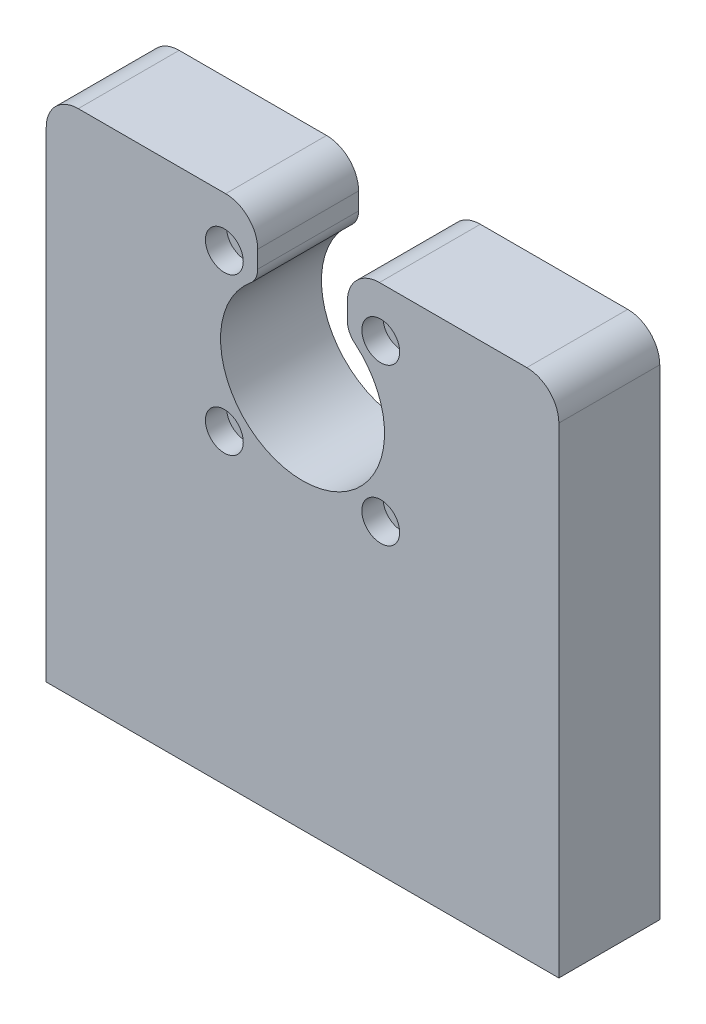
from build123d import *

# Parameters (mm, degrees)
BOSS_EXTRUDE1_DEPTH = 20
SKETCH2_R           = 16.25
SKETCH2_R_2         = 2.15
CUT_EXTRUDE1_DEPTH  = 20
SKETCH5_R           = 3.75
CUT_EXTRUDE4_DEPTH  = 4.2
FILLET3_R           = 4
FILLET4_R           = 6.35


with BuildPart() as part:
    # Sketch1 → Boss-Extrude1 (new body)
    with BuildSketch(Plane.XY):
        Polygon((50.8, 25.4), (8.89, 25.4), (8.89, 13.302928249), (-8.89, 13.302928249), (-8.89, 25.4), (-50.8, 25.4), (-50.8, -76.2), (50.8, -76.2), align=None)
    extrude(amount=BOSS_EXTRUDE1_DEPTH)

    # Sketch2 → Cut-Extrude1 (cut)
    with BuildSketch(Plane.XY.offset(20)):
        Circle(SKETCH2_R)
        with Locations((-15.5, -15.5)):
            Circle(SKETCH2_R_2)
        with Locations((-15.5, 15.5)):
            Circle(SKETCH2_R_2)
        with Locations((15.5, -15.5)):
            Circle(SKETCH2_R_2)
        with Locations((15.5, 15.5)):
            Circle(SKETCH2_R_2)
    extrude(amount=-CUT_EXTRUDE1_DEPTH, mode=Mode.SUBTRACT)

    # Sketch5 → Cut-Extrude4 (cut)
    with BuildSketch(Plane.XY.offset(20)):
        with Locations((-15.5, 15.5)):
            Circle(SKETCH5_R)
        with Locations((15.5, 15.5)):
            Circle(SKETCH5_R)
        with Locations((15.5, -15.5)):
            Circle(SKETCH5_R)
        with Locations((-15.5, -15.5)):
            Circle(SKETCH5_R)
    extrude(amount=-CUT_EXTRUDE4_DEPTH, mode=Mode.SUBTRACT)

    # Fillet3
    fillet3_edges = [part.edges().sort_by_distance(p)[0] for p in [
        (8.89, 13.602587989, 10),
        (-8.89, 13.602587989, 10),
    ]]
    fillet(fillet3_edges, radius=FILLET3_R)

    # Fillet4
    fillet4_edges = [part.edges().sort_by_distance(p)[0] for p in [
        (-50.8, 25.4, 10),
        (-8.89, 25.4, 10),
        (8.89, 25.4, 10),
        (50.8, 25.4, 10),
    ]]
    fillet(fillet4_edges, radius=FILLET4_R)


solid = part.part
